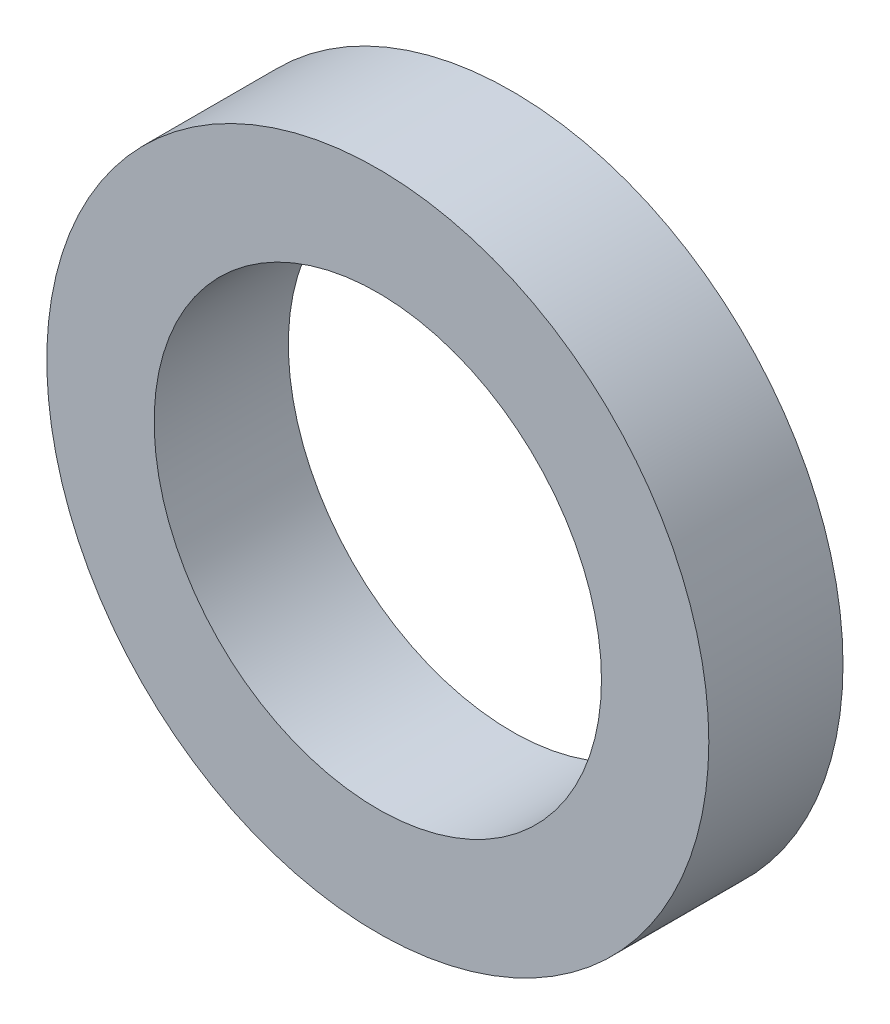
from build123d import *

# Parameters (mm, degrees)
SKETCH1_R           = 3.7
SKETCH1_R_2         = 2.5
BOSS_EXTRUDE1_DEPTH = 1.5


with BuildPart() as part:
    # Sketch1 → Boss-Extrude1 (new body)
    with BuildSketch(Plane.XY):
        Circle(SKETCH1_R)
        Circle(SKETCH1_R_2, mode=Mode.SUBTRACT)
    extrude(amount=BOSS_EXTRUDE1_DEPTH)


solid = part.part
